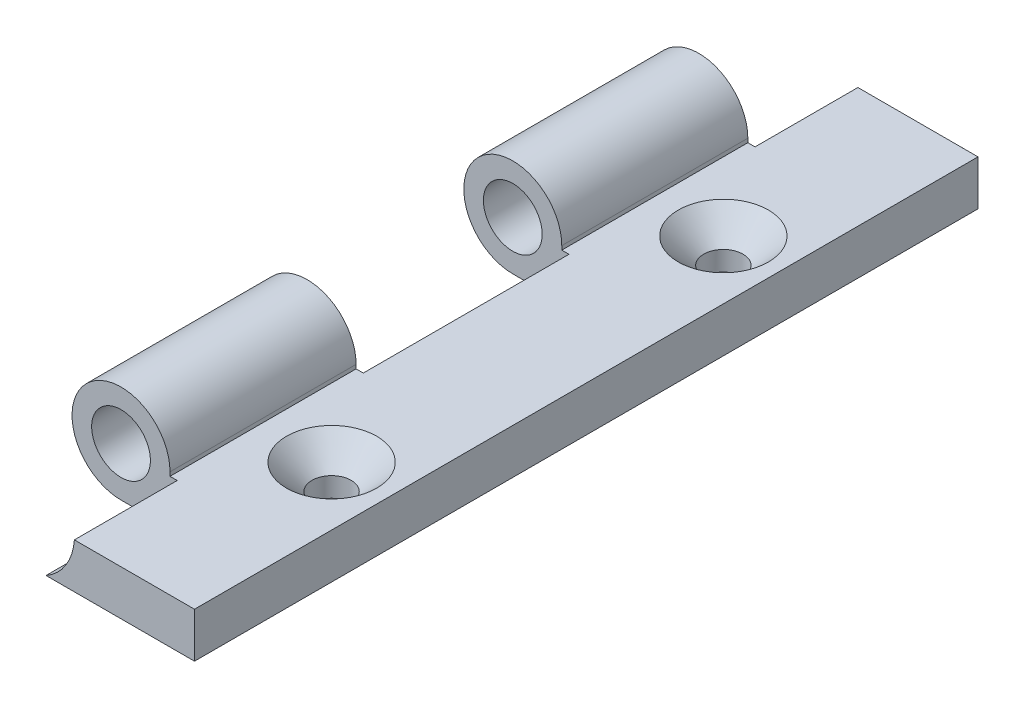
from build123d import *

# Parameters (mm, degrees)
SKETCH1_W           = 9
SKETCH1_H           = 40
BOSS_EXTRUDE1_DEPTH = 2.5
BOSS_EXTRUDE2_START = -5.25
SKETCH2_R           = 2.5
BOSS_EXTRUDE2_DEPTH = 9.5
SKETCH3_R           = 1.5
CUT_EXTRUDE1_DEPTH  = 42.919565837
SKETCH4_R           = 2.875
CUT_EXTRUDE2_DEPTH  = 5.25
CUT_EXTRUDE3_START  = -14.75
SKETCH4_2_R         = 2.875
CUT_EXTRUDE3_DEPTH  = 5.25
SKETCH5_R           = 1
CUT_EXTRUDE4_DEPTH  = 42.695323479
CHAMFER1_SIZE       = 1.5
CHAMFER2_SIZE       = 1.5
SKETCH7_W           = 6.5
SKETCH7_H           = 0.2
CUT_EXTRUDE5_DEPTH  = 42.919565837


with BuildPart() as part:
    # Sketch1 → Boss-Extrude1 (new body)
    with BuildSketch(Plane(origin=(0, 0, 0), x_dir=(1, 0, 0), z_dir=(0, 1, 0))):
        with Locations((-4.5, 20)):
            Rectangle(SKETCH1_W, SKETCH1_H)
    extrude(amount=BOSS_EXTRUDE1_DEPTH)

    # Sketch2 → Boss-Extrude2 (add)
    with BuildSketch(Plane.XY.offset(BOSS_EXTRUDE2_START)):
        with Locations((-9, 2.5)):
            Circle(SKETCH2_R)
    boss_extrude2 = extrude(amount=-BOSS_EXTRUDE2_DEPTH)

    # Sketch3 → Cut-Extrude1 (cut, through all)
    with BuildSketch(Plane.XY):
        with Locations((-9, 2.5)):
            Circle(SKETCH3_R)
    cut_extrude1 = extrude(amount=-CUT_EXTRUDE1_DEPTH, mode=Mode.SUBTRACT)

    # Sketch4 → Cut-Extrude2 (cut)
    with BuildSketch(Plane.XY):
        with Locations((-9, 2.5)):
            Circle(SKETCH4_R)
    cut_extrude2 = extrude(amount=-CUT_EXTRUDE2_DEPTH, mode=Mode.SUBTRACT)

    # Sketch4<2> → Cut-Extrude3 (cut)
    with BuildSketch(Plane.XY.offset(CUT_EXTRUDE3_START)):
        with Locations((-9, 2.5)):
            Circle(SKETCH4_2_R)
    cut_extrude3 = extrude(amount=-CUT_EXTRUDE3_DEPTH, mode=Mode.SUBTRACT)

    # Mirror2: Boss-Extrude2, Cut-Extrude1, Cut-Extrude2, Cut-Extrude3 across plane
    add(boss_extrude2.mirror(Plane.XY.offset(-20)))
    add(cut_extrude1.mirror(Plane.XY.offset(-20)), mode=Mode.SUBTRACT)
    add(cut_extrude2.mirror(Plane.XY.offset(-20)), mode=Mode.SUBTRACT)
    add(cut_extrude3.mirror(Plane.XY.offset(-20)), mode=Mode.SUBTRACT)

    # Sketch5 → Cut-Extrude4 (cut, through all)
    with BuildSketch(Plane(origin=(0, 2.5, 0), x_dir=(1, 0, 0), z_dir=(0, 1, 0))):
        with Locations(Location((-3, 10, 0), (0, 0, 270))):
            Circle(SKETCH5_R)
    cut_extrude4 = extrude(amount=-CUT_EXTRUDE4_DEPTH, mode=Mode.SUBTRACT)

    # Mirror3: Cut-Extrude4 across plane
    add(cut_extrude4.mirror(Plane.XY.offset(-20)), mode=Mode.SUBTRACT)

    # Chamfer1
    chamfer1_edges = [part.edges().sort_by_distance(p)[0] for p in [
        (-3, 2.5, -29),
    ]]
    chamfer(chamfer1_edges, length=CHAMFER1_SIZE)

    # Chamfer2
    chamfer2_edges = [part.edges().sort_by_distance(p)[0] for p in [
        (-3, 2.5, -11),
    ]]
    chamfer(chamfer2_edges, length=CHAMFER2_SIZE)

    # Sketch7 → Cut-Extrude5 (cut, through all)
    with BuildSketch(Plane.XY):
        with Locations((-3.25, 2.4)):
            Rectangle(SKETCH7_W, SKETCH7_H)
    extrude(amount=-CUT_EXTRUDE5_DEPTH, mode=Mode.SUBTRACT)


solid = part.part
